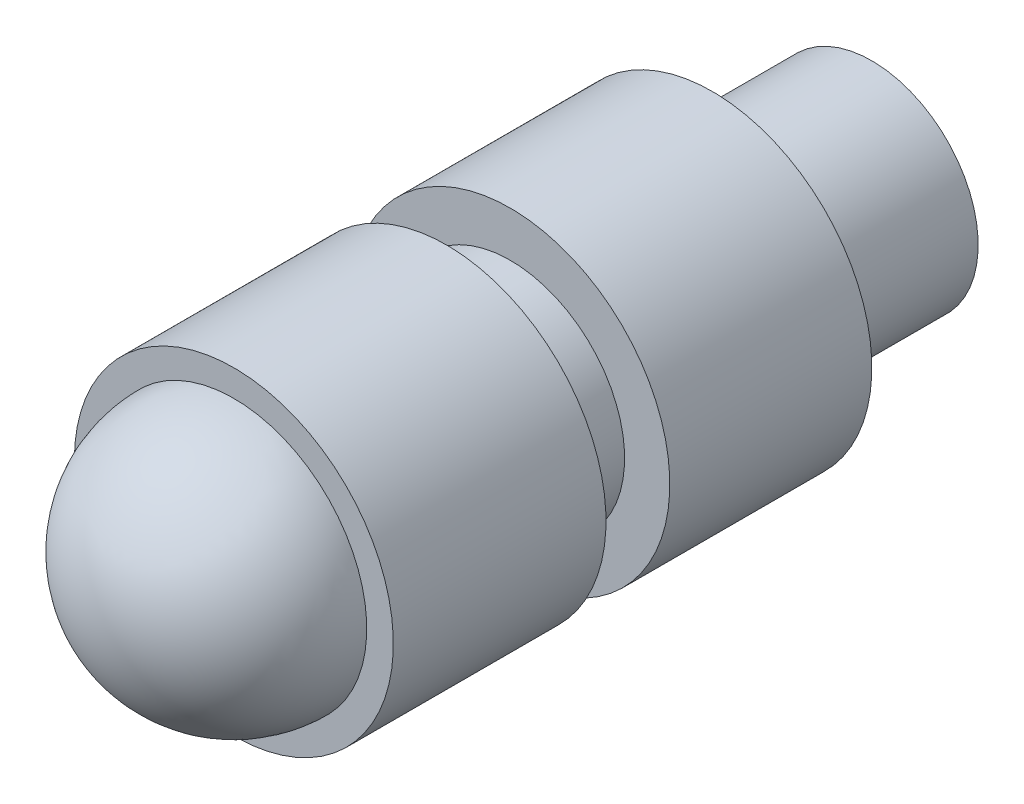
from build123d import *


with BuildPart() as part:
    # 草图1 → 旋转1 (revolve)
    with BuildSketch(Plane(origin=(0, 0, 0), x_dir=(1, 0, 0), z_dir=(0, 1, 0)), mode=Mode.PRIVATE) as revolve_1_sk:
        with BuildLine():
            Line((5, 0), (6, 0))
            Line((6, 0), (6, 8))
            Line((6, 8), (4.3, 8))
            Line((4.3, 8), (4.3, 10.4))
            Line((4.3, 10.4), (6, 10.4))
            Line((6, 10.4), (6, 18))
            Line((6, 18), (4, 18))
            Line((4, 18), (4, 24))
            Line((4, 24), (0, 24))
            Line((0, 24), (0, -5))
            ThreePointArc((0, -5), (3.5355, -3.5355), (5, 0))
        make_face()
    revolve(revolve_1_sk.sketch.rotate(Axis((0, 0, -30), (0, 0, 1)), 180), axis=Axis((0, 0, -30), (0, 0, 1)))


solid = part.part
